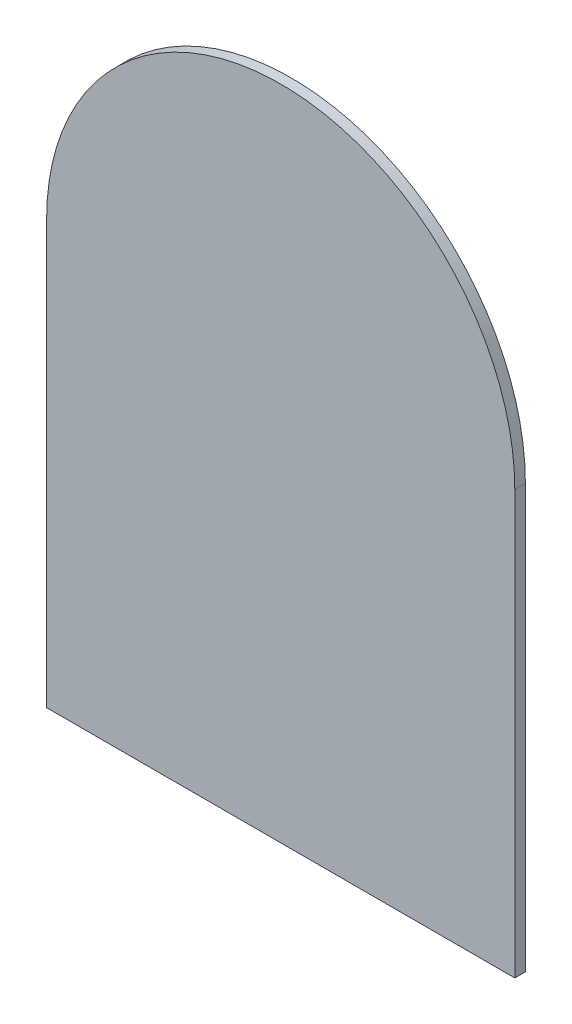
from build123d import *

# Parameters (mm, degrees)
BOSS_EXTRUDE1_DEPTH = 10


with BuildPart() as part:
    # Sketch1 → Boss-Extrude1 (new body)
    with BuildSketch(Plane.XY):
        with BuildLine():
            Line((0, 0), (-442.62, 0))
            Line((-442.62, 0), (-442.62, 400))
            ThreePointArc((-442.62, 400), (-221.31, 621.31), (0, 400))
            Line((0, 400), (0, 0))
        make_face()
    extrude(amount=BOSS_EXTRUDE1_DEPTH)


solid = part.part
